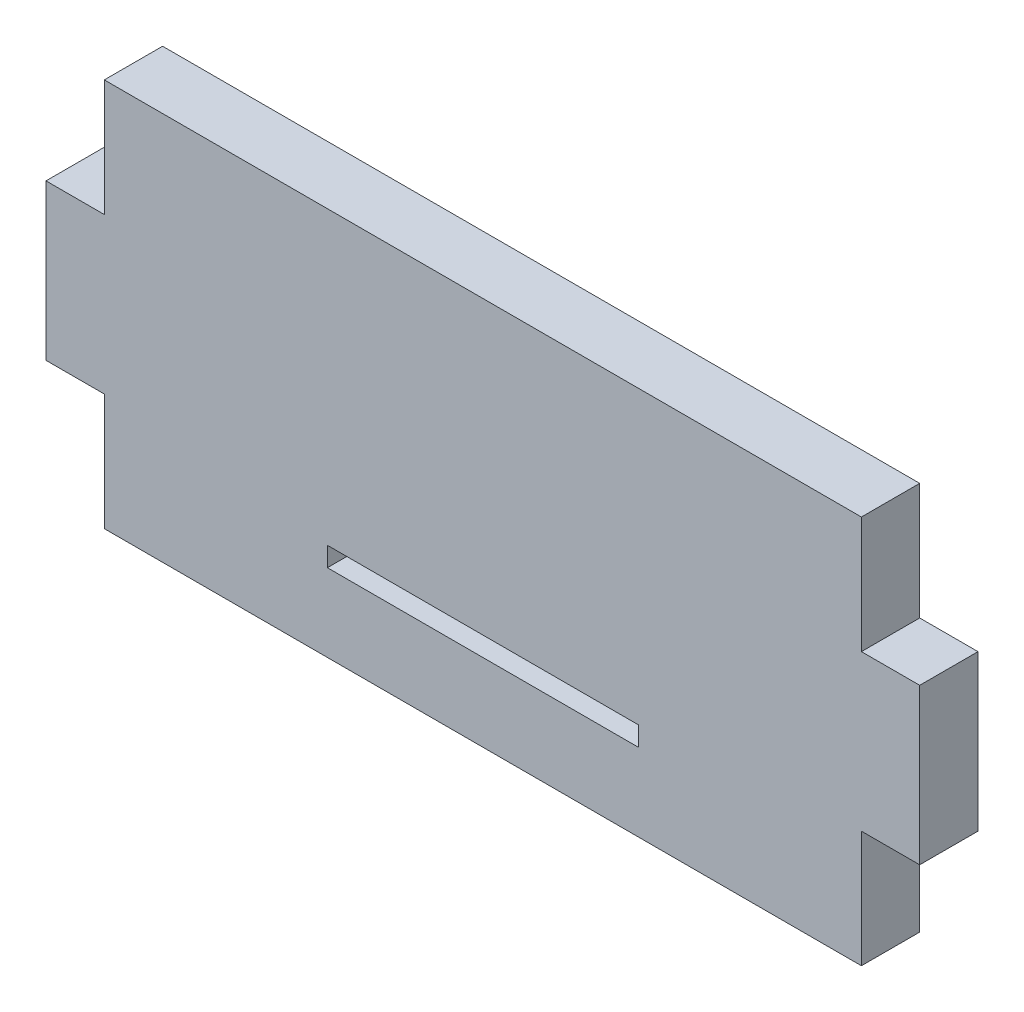
from build123d import *

# Parameters (mm, degrees)
SKETCH1_W           = 50.8
SKETCH1_H           = 3.175
BOSS_EXTRUDE1_DEPTH = 9.525


with BuildPart() as part:
    # Sketch1 → Boss-Extrude1 (new body)
    with BuildSketch(Plane.XY):
        Polygon((0, 44.45), (0, 63.5), (123.698, 63.5), (123.698, 44.45), (133.223, 44.45), (133.223, 19.05), (123.698, 19.05), (123.698, 0), (86.768463183, 0), (35.968463183, 0), (0, 0), (0, 19.05), (-9.525, 19.05), (-9.525, 44.45), align=None)
        with Locations((61.849, 14.2875)):
            Rectangle(SKETCH1_W, SKETCH1_H, mode=Mode.SUBTRACT)
    extrude(amount=BOSS_EXTRUDE1_DEPTH)


solid = part.part
